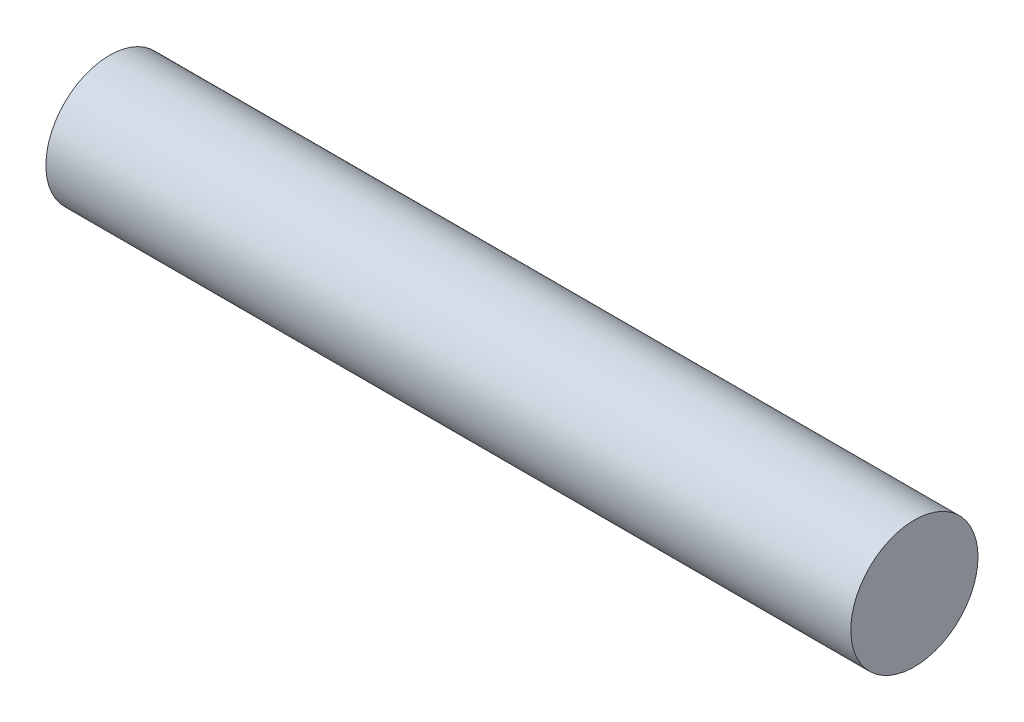
from build123d import *

# Parameters (mm, degrees)
SKETCH1_R           = 6.005394795
BOSS_EXTRUDE1_DEPTH = 76


with BuildPart() as part:
    # Sketch1 → Boss-Extrude1 (new body)
    with BuildSketch(Plane(origin=(0, 0, 0), x_dir=(0, 0, -1), z_dir=(1, 0, 0))):
        with Locations((0.267236561, -0.13361828)):
            Circle(SKETCH1_R)
    extrude(amount=BOSS_EXTRUDE1_DEPTH)


solid = part.part
